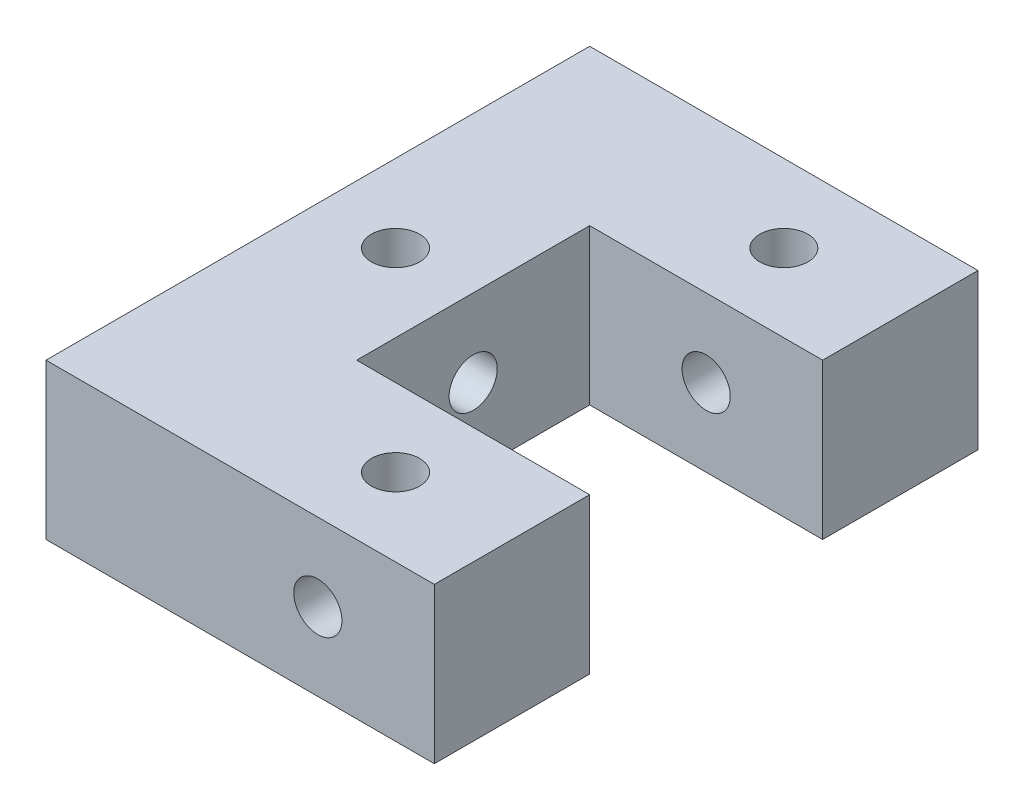
from build123d import *

# Parameters (mm, degrees)
SKETCH_1_R          = 1.55
EXTRUDE_1_DEPTH     = 10
CUT_EXTRUDE_1_REACH = 46.159
SKETCH_3_R          = 1.55
CUT_EXTRUDE_2_REACH = 46.159
SKETCH_4_R          = 1.55


with BuildPart() as part:
    # 草图1 → 凸台-拉伸1 (new body)
    with BuildSketch(Plane(origin=(0, 0, 0), x_dir=(1, 0, 0), z_dir=(0, 1, 0))):
        Polygon((0, 0), (25, 0), (25, -10), (10, -10), (10, -25), (25, -25), (25, -35), (0, -35), align=None)
        with Locations(Location((5, -17.5, 0), (0, 0, 270))):
            Circle(SKETCH_1_R, mode=Mode.SUBTRACT)
        with Locations(Location((17.5, -5, 0), (0, 0, 270))):
            Circle(SKETCH_1_R, mode=Mode.SUBTRACT)
        with Locations(Location((17.5, -30, 0), (0, 0, 270))):
            Circle(SKETCH_1_R, mode=Mode.SUBTRACT)
    extrude(amount=EXTRUDE_1_DEPTH)

    # 切除-拉伸1: up to this face of the body (flat: up to its plane)
    cut_extrude_1_end = Plane(part.part.faces().sort_by_distance((10, 5, 17.5))[0])
    # 草图3 → 切除-拉伸1 (cut, up to the picked face)
    with BuildSketch(Plane.ZY, mode=Mode.PRIVATE) as cut_extrude_1_sk1:
        with Locations((17.5, 5)):
            Circle(SKETCH_3_R)
    cut_extrude_1_tool1 = split(extrude(cut_extrude_1_sk1.sketch, amount=-CUT_EXTRUDE_1_REACH, mode=Mode.PRIVATE), bisect_by=cut_extrude_1_end, keep=Keep.BOTH, mode=Mode.PRIVATE)
    add(cut_extrude_1_tool1.solids().sort_by(Axis((0, 5, 17.5), (1, 0, 0)))[0], mode=Mode.SUBTRACT)

    # 切除-拉伸2: up to this face of the body (flat: up to its plane)
    cut_extrude_2_end = Plane(part.part.faces().sort_by_distance((12.5, 5, 0))[0])
    # 草图4 → 切除-拉伸2 (cut, up to the picked face)
    with BuildSketch(Plane.XY.offset(35), mode=Mode.PRIVATE) as cut_extrude_2_sk1:
        with Locations((17.5, 5)):
            Circle(SKETCH_4_R)
    cut_extrude_2_tool1 = split(extrude(cut_extrude_2_sk1.sketch, amount=-CUT_EXTRUDE_2_REACH, mode=Mode.PRIVATE), bisect_by=cut_extrude_2_end, keep=Keep.BOTH, mode=Mode.PRIVATE)
    add(cut_extrude_2_tool1.solids().sort_by(Axis((17.5, 5, 35), (0, 0, -1)))[0], mode=Mode.SUBTRACT)


solid = part.part
